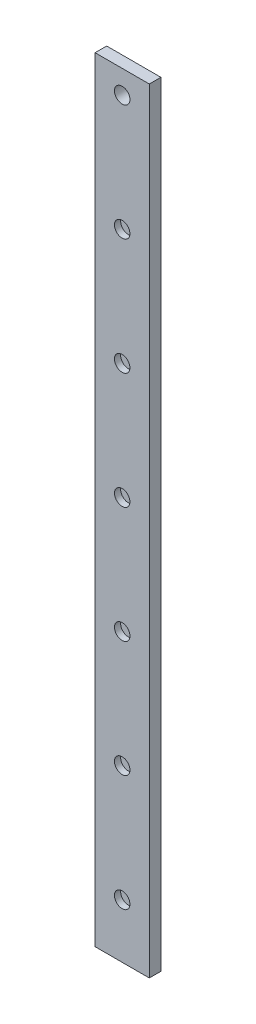
from build123d import *

# Parameters (mm, degrees)
SKETCH1_W           = 70
SKETCH1_H           = 15
BOSS_EXTRUDE1_DEPTH = 1000
SKETCH2_R           = 10
CUT_EXTRUDE1_DEPTH  = 15
SKETCH3_R           = 10
CUT_EXTRUDE2_DEPTH  = 8


with BuildPart() as part:
    # Sketch1 → Boss-Extrude1 (new body)
    with BuildSketch(Plane(origin=(0, 0, 0), x_dir=(1, 0, 0), z_dir=(0, 1, 0))):
        with Locations((-35, -7.5)):
            Rectangle(SKETCH1_W, SKETCH1_H)
    extrude(amount=BOSS_EXTRUDE1_DEPTH)

    # Sketch2 → Cut-Extrude1 (cut)
    with BuildSketch(Plane.XY.offset(15)):
        with Locations((-35, 970)):
            Circle(SKETCH2_R)
    extrude(amount=-CUT_EXTRUDE1_DEPTH, mode=Mode.SUBTRACT)

    # Sketch3 → Cut-Extrude2 (cut)
    with BuildSketch(Plane.XY.offset(15)):
        with Locations((-35, 820)):
            Circle(SKETCH3_R)
        with Locations((-35, 670)):
            Circle(SKETCH3_R)
        with Locations((-35, 520)):
            Circle(SKETCH3_R)
        with Locations((-35, 370)):
            Circle(SKETCH3_R)
        with Locations((-35, 220)):
            Circle(SKETCH3_R)
        with Locations((-35, 70)):
            Circle(SKETCH3_R)
    extrude(amount=-CUT_EXTRUDE2_DEPTH, mode=Mode.SUBTRACT)


solid = part.part
